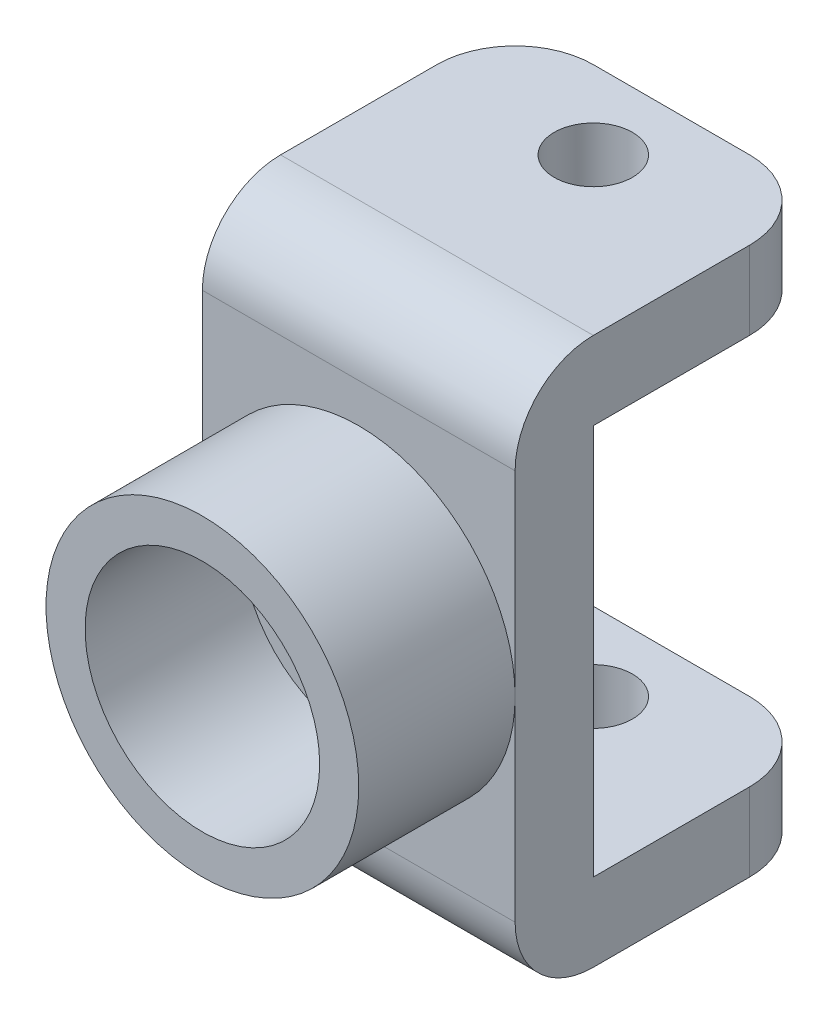
from build123d import *

# Parameters (mm, degrees)
SKETCH1_W           = 40
SKETCH1_H           = 50
BOSS_EXTRUDE1_DEPTH = 10
SKETCH2_W           = 40
SKETCH2_H           = 10
BOSS_EXTRUDE2_DEPTH = 20
FILLET1_R           = 10
SKETCH3_R           = 20
SKETCH3_R_2         = 15
BOSS_EXTRUDE3_DEPTH = 20
SKETCH4_R           = 5
CUT_EXTRUDE1_DEPTH  = 79.74007874


with BuildPart() as part:
    # Sketch1 → Boss-Extrude1 (new body)
    with BuildSketch(Plane.XY):
        Rectangle(SKETCH1_W, SKETCH1_H)
    extrude(amount=BOSS_EXTRUDE1_DEPTH)

    # Sketch2 → Boss-Extrude2 (add, symmetric)
    with BuildSketch(Plane(origin=(0, 0, 0), x_dir=(0, 0, -1), z_dir=(1, 0, 0))):
        with Locations((10, 30)):
            Rectangle(SKETCH2_W, SKETCH2_H)
        with Locations((10, -30)):
            Rectangle(SKETCH2_W, SKETCH2_H)
    extrude(amount=BOSS_EXTRUDE2_DEPTH, both=True)

    # Fillet1
    fillet1_edges = [part.edges().sort_by_distance(p)[0] for p in [
        (0, 35, 10),
        (-20, 30, -30),
        (20, 30, -30),
        (0, -35, 10),
        (-20, -30, -30),
        (20, -30, -30),
    ]]
    fillet(fillet1_edges, radius=FILLET1_R)

    # Sketch3 → Boss-Extrude3 (add)
    with BuildSketch(Plane.XY.offset(10)):
        Circle(SKETCH3_R)
        Circle(SKETCH3_R_2, mode=Mode.SUBTRACT)
    extrude(amount=BOSS_EXTRUDE3_DEPTH)

    # Sketch4 → Cut-Extrude1 (cut, through all)
    with BuildSketch(Plane.XZ.offset(35)):
        with Locations(Location((0, -20, 0), (0, 0, 270))):
            Circle(SKETCH4_R)
    extrude(amount=-CUT_EXTRUDE1_DEPTH, mode=Mode.SUBTRACT)


solid = part.part
